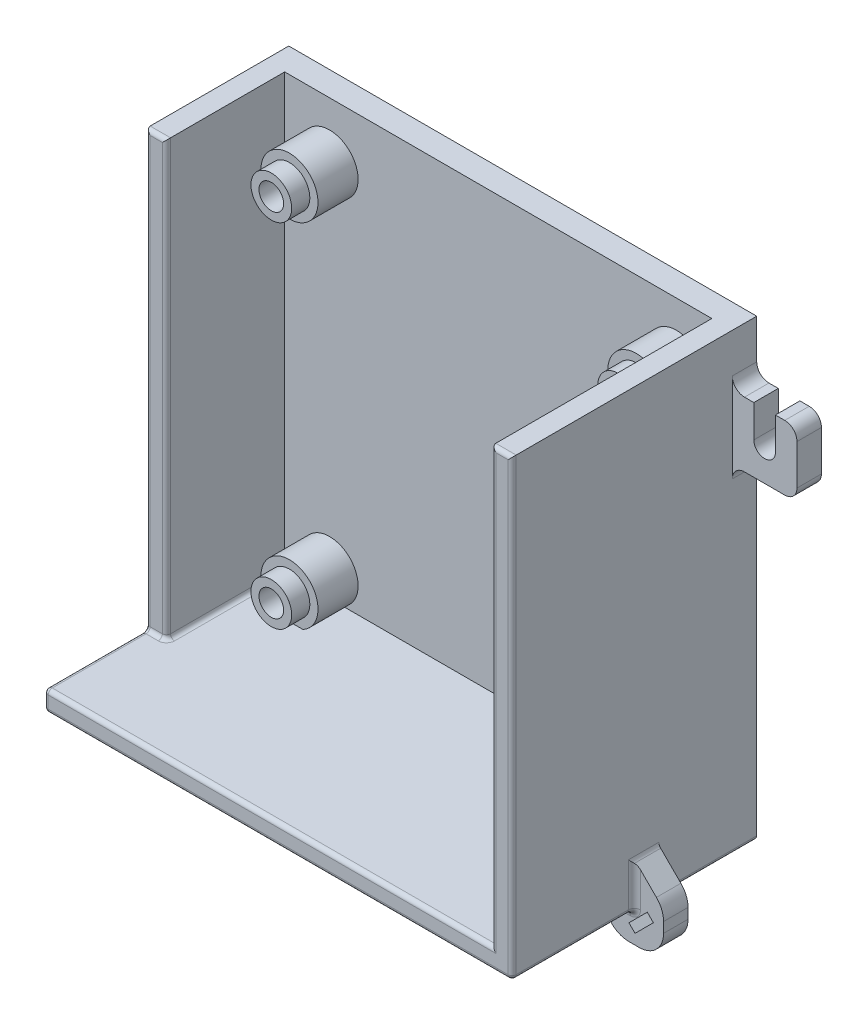
from build123d import *

# Parameters (mm, degrees)
SKETCH1_W            = 104.775
SKETCH1_H            = 106.3625
BOSS_EXTRUDE1_DEPTH  = 6
BOSS_EXTRUDE2_DEPTH  = 35
SKETCH3_R            = 5
SKETCH3_R_2          = 3.025
BOSS_EXTRUDE3_DEPTH  = 14.2875
SKETCH4_R            = 7
SKETCH4_R_2          = 3.025
BOSS_EXTRUDE4_DEPTH  = 9.8425
SKETCH6_W            = 15.875
SKETCH6_H            = 15.875
SKETCH6_W_2          = 15.88
SKETCH6_H_2          = 15.88
BOSS_EXTRUDE5_DEPTH  = 6
M5_CLEARANCE_HOLE2_D = 5.3
FILLET2_R            = 3
BOSS_EXTRUDE6_DEPTH  = 25
FILLET3_R            = 1
BOSS_EXTRUDE7_START  = 6
BOSS_EXTRUDE7_DEPTH  = 6
FILLET4_R            = 6
FILLET5_R            = 1.5
CUT_EXTRUDE1_DEPTH   = 113.041039013


with BuildPart() as part:
    # Sketch1 → Boss-Extrude1 (new body)
    with BuildSketch(Plane.XY):
        Rectangle(SKETCH1_W, SKETCH1_H)
    extrude(amount=BOSS_EXTRUDE1_DEPTH)

    # Sketch2 → Boss-Extrude2 (add)
    with BuildSketch(Plane.XY):
        Polygon((-57.3875, -53.18125), (-57.3875, -58.18125), (-52.3875, -58.18125), (57.3875, -58.18125), (57.3875, 53.18125), (52.3875, 53.18125), (52.3875, -53.18125), (-52.3875, -53.18125), (-52.3875, 53.18125), (-57.3875, 53.18125), align=None)
    extrude(amount=BOSS_EXTRUDE2_DEPTH)

    # Sketch3 → Boss-Extrude3 (add)
    # profile 1 of 4: a face of its own
    with BuildSketch(Plane.XY.offset(6)):
        with Locations((43.708, 39.35095)):
            Circle(SKETCH3_R)
        with Locations((43.708, 39.35095)):
            Circle(SKETCH3_R_2, mode=Mode.SUBTRACT)
    # profile 2 of 4: a face of its own
    with BuildSketch(Plane.XY.offset(6)):
        with Locations((-41.382, 39.35095)):
            Circle(SKETCH3_R)
        with Locations((-41.382, 39.35095)):
            Circle(SKETCH3_R_2, mode=Mode.SUBTRACT)
    # profile 3 of 4: a face of its own
    with BuildSketch(Plane.XY.offset(6)):
        with Locations((-41.382, -47.00905)):
            Circle(SKETCH3_R)
        with Locations((-41.382, -47.00905)):
            Circle(SKETCH3_R_2, mode=Mode.SUBTRACT)
    # profile 4 of 4: a face of its own
    with BuildSketch(Plane.XY.offset(6)):
        with Locations((43.708, -47.00905)):
            Circle(SKETCH3_R)
        with Locations((43.708, -47.00905)):
            Circle(SKETCH3_R_2, mode=Mode.SUBTRACT)
    extrude(amount=BOSS_EXTRUDE3_DEPTH)

    # Sketch4 → Boss-Extrude4 (add)
    # profile 1 of 4: a face of its own
    with BuildSketch(Plane.XY.offset(6)):
        with Locations((43.708, 39.35095)):
            Circle(SKETCH4_R)
        with Locations((43.708, 39.35095)):
            Circle(SKETCH4_R_2, mode=Mode.SUBTRACT)
    # profile 2 of 4: a face of its own
    with BuildSketch(Plane.XY.offset(6)):
        with Locations((-41.382, 39.35095)):
            Circle(SKETCH4_R)
        with Locations((-41.382, 39.35095)):
            Circle(SKETCH4_R_2, mode=Mode.SUBTRACT)
    # profile 3 of 4: a face of its own
    with BuildSketch(Plane.XY.offset(6)):
        with Locations((-41.382, -47.00905)):
            Circle(SKETCH4_R)
        with Locations((-41.382, -47.00905)):
            Circle(SKETCH4_R_2, mode=Mode.SUBTRACT)
    # profile 4 of 4: a face of its own
    with BuildSketch(Plane.XY.offset(6)):
        with Locations((43.708, -47.00905)):
            Circle(SKETCH4_R)
        with Locations((43.708, -47.00905)):
            Circle(SKETCH4_R_2, mode=Mode.SUBTRACT)
    extrude(amount=BOSS_EXTRUDE4_DEPTH)

    # Sketch6 → Boss-Extrude5 (add)
    with BuildSketch(Plane.XY):
        with Locations((65.325, 32.54375)):
            Rectangle(SKETCH6_W, SKETCH6_H)
        with Locations((-65.3275, -50.24125)):
            Rectangle(SKETCH6_W_2, SKETCH6_H_2)
    extrude(amount=BOSS_EXTRUDE5_DEPTH)

    # M5 Clearance Hole2 (through all)
    with Locations(Plane.XY.offset(6)):
        with Locations((65.325, 32.54375), (-65.3275, -50.24125)):
            Hole(M5_CLEARANCE_HOLE2_D / 2)

    # Fillet2
    fillet2_edges = [part.edges().sort_by_distance(p)[0] for p in [
        (-73.2675, -42.30125, 3),
        (-73.2675, -58.18125, 3),
        (73.2625, 24.60625, 3),
        (73.2625, 40.48125, 3),
        (57.3875, 40.48125, 3),
        (57.3875, 24.60625, 3),
    ]]
    fillet(fillet2_edges, radius=FILLET2_R)

    # Sketch9 → Boss-Extrude6 (add)
    with BuildSketch(Plane.XY.offset(35)):
        Polygon((52.3875, -53.18125), (-52.3875, -53.18125), (-57.3875, -53.18125), (-57.3875, -58.18125), (57.3875, -58.18125), (57.3875, 53.18125), (52.3875, 53.18125), align=None)
    extrude(amount=BOSS_EXTRUDE6_DEPTH)

    # Fillet3
    fillet3_edges = [part.edges().sort_by_distance(p)[0] for p in [
        (-52.3875, -53.18125, 20.5),
        (-57.3875, -58.18125, 33),
        (57.3875, -58.18125, 30),
        (-52.3875, 0, 35),
        (-54.8875, 53.18125, 35),
        (-57.3875, 0, 35),
        (-54.8875, -53.18125, 35),
        (-57.3875, -53.18125, 47.5),
        (-2.5, -53.18125, 60),
        (-57.3875, -55.68125, 60),
        (0, -58.18125, 60),
        (57.3875, -2.5, 60),
        (54.8875, 53.18125, 60),
        (52.3875, 0, 60),
    ]]
    fillet(fillet3_edges, radius=FILLET3_R)

    # Sketch10 → Boss-Extrude7 (add)
    with BuildSketch(Plane(origin=(0, 0, 30), x_dir=(-1, 0, 0), z_dir=(0, 0, -1)).offset(BOSS_EXTRUDE7_START)):
        with BuildLine():
            ThreePointArc((-56.3875, -58.18125), (-56.770183432, -58.105129533), (-57.094606781, -57.888356781))
            ThreePointArc((-57.094606781, -57.888356781), (-57.311379533, -57.563933432), (-57.3875, -57.18125))
            Line((-57.3875, -57.18125), (-57.3875, -47.18125))
            Line((-57.3875, -47.18125), (-64.544354249, -54.338104249))
            Line((-64.544354249, -54.338104249), (-64.544354249, -65.338104249))
            Line((-64.544354249, -65.338104249), (-53.544354249, -65.338104249))
            Line((-53.544354249, -65.338104249), (-46.3875, -58.18125))
            Line((-46.3875, -58.18125), (-56.3875, -58.18125))
        make_face()
        Polygon((-60.544354249, -56.838104249), (-56.044354249, -61.338104249), (-57.544354249, -62.838104249), (-62.044354249, -58.338104249), align=None, mode=Mode.SUBTRACT)
    extrude(amount=-BOSS_EXTRUDE7_DEPTH)

    # Fillet4
    fillet4_edges = [part.edges().sort_by_distance(p)[0] for p in [
        (64.544354249, -54.338104249, 27),
        (64.544354249, -65.338104249, 27),
        (53.544354249, -65.338104249, 27),
    ]]
    fillet(fillet4_edges, radius=FILLET4_R)

    # Fillet5
    fillet5_edges = [part.edges().sort_by_distance(p)[0] for p in [
        (57.3875, -52.18125, 30),
        (57.3875, -47.18125, 27),
        (51.3875, -58.18125, 30),
        (46.3875, -58.18125, 27),
        (57.094606781, -57.888356781, 30),
    ]]
    fillet(fillet5_edges, radius=FILLET5_R)

    # Sketch11 → Cut-Extrude1 (cut, through all)
    with BuildSketch(Plane.XY.offset(6)):
        with BuildLine():
            Line((-67.9775, -42.30125), (-67.9775, -50.24125))
            ThreePointArc((-67.9775, -50.24125), (-65.3275, -47.59125), (-62.6775, -50.24125))
            Line((-62.6775, -50.24125), (-62.6775, -42.30125))
            Line((-62.6775, -42.30125), (-67.9775, -42.30125))
        make_face()
        with BuildLine():
            Line((62.675, 40.48125), (62.675, 32.54375))
            ThreePointArc((62.675, 32.54375), (65.325, 35.19375), (67.975, 32.54375))
            Line((67.975, 32.54375), (67.975, 40.48125))
            Line((67.975, 40.48125), (62.675, 40.48125))
        make_face()
    extrude(amount=-CUT_EXTRUDE1_DEPTH, mode=Mode.SUBTRACT)


solid = part.part
